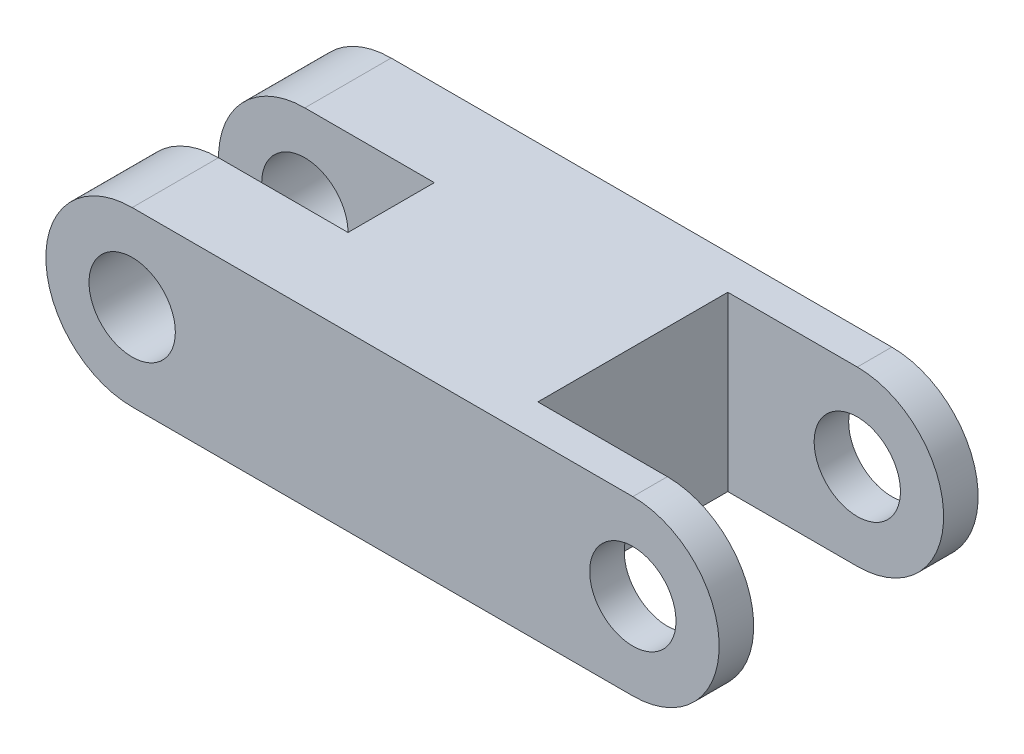
from build123d import *

# Parameters (mm, degrees)
SKETCH1_R           = 5
BOSS_EXTRUDE1_DEPTH = 30
SKETCH2_W           = 25
SKETCH2_H           = 10
SKETCH2_H_2         = 22
CUT_EXTRUDE1_DEPTH  = 77.962109955


with BuildPart() as part:
    # Sketch1 → Boss-Extrude1 (new body)
    with BuildSketch(Plane.XY):
        with BuildLine():
            Line((0, 10), (57.993870082, 10))
            ThreePointArc((57.993870082, 10), (67.993870082, 0), (57.993870082, -10))
            Line((57.993870082, -10), (0, -10))
            ThreePointArc((0, -10), (-10, 0), (0, 10))
        make_face()
        Circle(SKETCH1_R, mode=Mode.SUBTRACT)
        with Locations((57.993870082, 0)):
            Circle(SKETCH1_R, mode=Mode.SUBTRACT)
    extrude(amount=BOSS_EXTRUDE1_DEPTH)

    # Sketch2 → Cut-Extrude1 (cut, through all)
    with BuildSketch(Plane(origin=(0, 10, 0), x_dir=(1, 0, 0), z_dir=(0, 1, 0))):
        with Locations((2.5, -15)):
            Rectangle(SKETCH2_W, SKETCH2_H)
        with Locations((55.493870082, -15)):
            Rectangle(SKETCH2_W, SKETCH2_H_2)
    extrude(amount=-CUT_EXTRUDE1_DEPTH, mode=Mode.SUBTRACT)


solid = part.part
